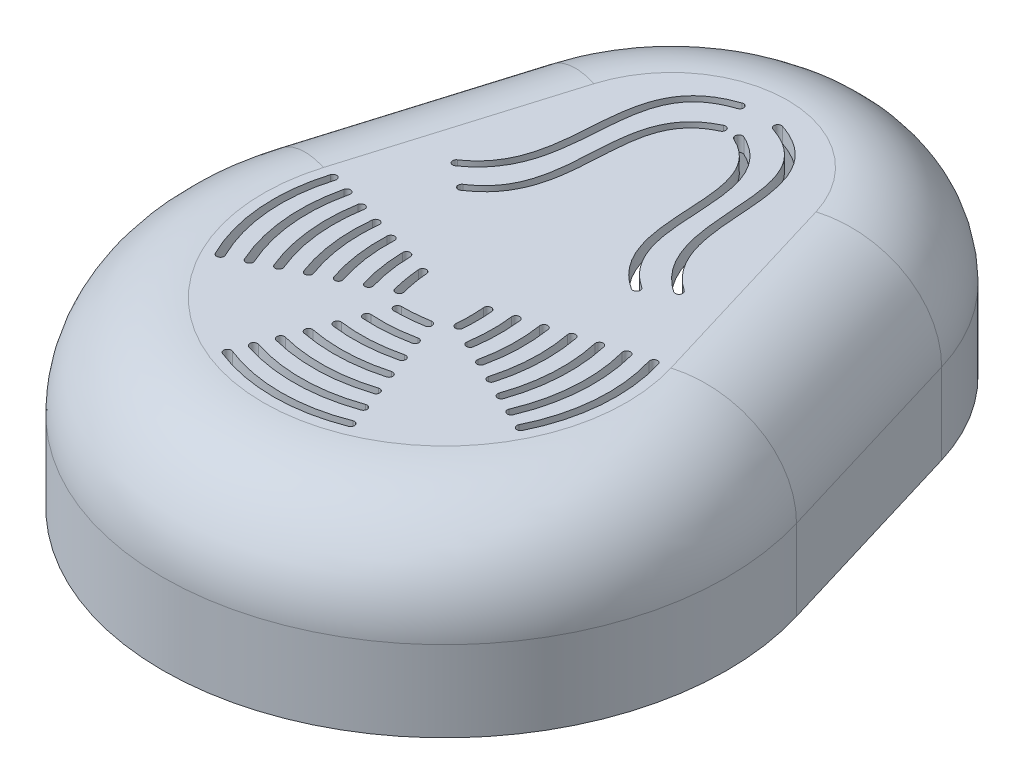
from build123d import *

# Parameters (mm, degrees)
SALIENTE_EXTRUIR3_DEPTH = 36
REDONDEO1_R             = 20
VACIADO1_T              = -3
CORTAR_EXTRUIR2_DEPTH   = 100.538937105
SALIENTE_EXTRUIR4_REACH = 101.539
CROQUIS11_R             = 3.6
CORTAR_EXTRUIR3_DEPTH   = 3


with BuildPart() as part:
    # Croquis6 → Saliente-Extruir3 (new body)
    with BuildSketch(Plane(origin=(0, 0, 0), x_dir=(1, 0, 0), z_dir=(0, 1, 0))):
        with BuildLine():
            Line((-53.612307413, 2.177777778), (-41.166593192, 43.422222222))
            ThreePointArc((-41.166593192, 43.422222222), (0, 74), (41.166593192, 43.422222222))
            Line((41.166593192, 43.422222222), (53.612307413, 2.177777778))
            ThreePointArc((53.612307413, 2.177777778), (0, -70), (-53.612307413, 2.177777778))
        make_face()
    extrude(amount=SALIENTE_EXTRUIR3_DEPTH)

    # Redondeo1
    redondeo1_edges = [part.edges().sort_by_distance(p)[0] for p in [
        (0, 36, -74),
        (-47.389450303, 36, -22.8),
        (0, 36, 70),
        (47.389450303, 36, -22.8),
    ]]
    fillet(redondeo1_edges, radius=REDONDEO1_R)

    # Vaciado1
    vaciado1_openings = [part.faces().sort_by_distance(p)[0] for p in [
        (0, 0, 0.578119369),
    ]]
    offset(amount=VACIADO1_T, openings=vaciado1_openings, kind=Kind.INTERSECTION)

    # Croquis8 → Cortar-Extruir2 (cut, through all)
    with BuildSketch(Plane(origin=(0, 36, 0), x_dir=(1, 0, 0), z_dir=(0, 1, 0))):
        with BuildLine():
            ThreePointArc((-32.550329501, -4.177777778), (-33.881791217, -16.832706114), (-30.467457358, -29.090859555))
            ThreePointArc((-30.467457358, -29.090859555), (-29.462494485, -29.430049212), (-29.123304828, -28.425086339))
            ThreePointArc((-29.123304828, -28.425086339), (-32.38700631, -16.707733785), (-31.114285552, -4.611111111))
            ThreePointArc((-31.114285552, -4.611111111), (-31.61564086, -3.67642247), (-32.550329501, -4.177777778))
        make_face()
        with BuildLine():
            ThreePointArc((-28.69329001, -5.341658438), (-29.441166671, -16.442842187), (-26.56514543, -27.191056082))
            ThreePointArc((-26.56514543, -27.191056082), (-25.572320196, -27.564282628), (-25.19909365, -26.571457394))
            ThreePointArc((-25.19909365, -26.571457394), (-27.948231601, -16.297429406), (-27.233349499, -5.686003764))
            ThreePointArc((-27.233349499, -5.686003764), (-27.791147092, -4.783860845), (-28.69329001, -5.341658438))
        make_face()
        with BuildLine():
            ThreePointArc((-24.712728102, -6.542812597), (-24.993827449, -16.05576998), (-22.627303805, -25.273955314))
            ThreePointArc((-22.627303805, -25.273955314), (-21.647781512, -25.680816563), (-21.240920263, -24.701294269))
            ThreePointArc((-21.240920263, -24.701294269), (-23.503038451, -15.889793582), (-23.234340546, -6.796525495))
            ThreePointArc((-23.234340546, -6.796525495), (-23.846677874, -5.930475268), (-24.712728102, -6.542812597))
        make_face()
        with BuildLine():
            ThreePointArc((-20.606501833, -7.781886594), (-20.539215096, -15.674786748), (-18.653770784, -23.339478529))
            ThreePointArc((-18.653770784, -23.339478529), (-17.688722035, -23.779570465), (-17.248630099, -22.814521716))
            ThreePointArc((-17.248630099, -22.814521716), (-19.050893044, -15.487978103), (-19.115211249, -7.943294132))
            ThreePointArc((-19.115211249, -7.943294132), (-19.780152772, -7.116945071), (-20.606501833, -7.781886594))
        make_face()
        with BuildLine():
            ThreePointArc((-16.37090047, -9.060000164), (-16.076541358, -15.303434023), (-14.644257223, -21.38748496))
            ThreePointArc((-14.644257223, -21.38748496), (-13.694862107, -21.860400295), (-13.221946773, -20.911005179))
            ThreePointArc((-13.221946773, -20.911005179), (-14.591041901, -15.095368254), (-14.872414582, -9.127380006))
            ThreePointArc((-14.872414582, -9.127380006), (-15.587967605, -8.344447141), (-16.37090047, -9.060000164))
        make_face()
        with BuildLine():
            ThreePointArc((-12.000412156, -10.378816535), (-11.604733963, -14.945658176), (-10.598341372, -19.417769282))
            ThreePointArc((-10.598341372, -19.417769282), (-9.665793809, -19.923095953), (-9.160467139, -18.990548391))
            ThreePointArc((-9.160467139, -18.990548391), (-10.122460057, -14.715736303), (-10.500681859, -10.350372971))
            ThreePointArc((-10.500681859, -10.350372971), (-11.26476879, -9.614729605), (-12.000412156, -10.378816535))
        make_face()
        with BuildLine():
            ThreePointArc((-7.487350668, -11.740655064), (-7.122352796, -14.606017153), (-6.515461153, -17.430057853))
            ThreePointArc((-6.515461153, -17.430057853), (-5.6009735, -17.967377435), (-5.063653919, -17.052889781))
            ThreePointArc((-5.063653919, -17.052889781), (-5.64377093, -14.353439112), (-5.992665955, -11.614490056))
            ThreePointArc((-5.992665955, -11.614490056), (-6.803090815, -10.930230204), (-7.487350668, -11.740655064))
        make_face()
        with BuildLine():
            ThreePointArc((-12.5, -45.618823508), (0, -48), (12.5, -45.618823508))
            ThreePointArc((12.5, -45.618823508), (12.921738754, -44.645614165), (11.948529412, -44.223875412))
            ThreePointArc((11.948529412, -44.223875412), (0, -46.5), (-11.948529412, -44.223875412))
            ThreePointArc((-11.948529412, -44.223875412), (-12.921738754, -44.645614165), (-12.5, -45.618823508))
        make_face()
        with BuildLine():
            ThreePointArc((-11.018817033, -41.872162482), (-0.018538349, -43.542332833), (10.931922301, -41.571796951))
            ThreePointArc((10.931922301, -41.571796951), (11.38656836, -40.613518828), (10.428290237, -40.158872769))
            ThreePointArc((10.428290237, -40.158872769), (-0.039061855, -42.042473244), (-10.554034126, -40.445986879))
            ThreePointArc((-10.554034126, -40.445986879), (-11.499513381, -40.926683227), (-11.018817033, -41.872162482))
        make_face()
        with BuildLine():
            ThreePointArc((-9.490198901, -38.005513929), (-0.033735252, -39.078206927), (9.349567598, -37.487923103))
            ThreePointArc((9.349567598, -37.487923103), (9.836623088, -36.545703941), (8.894403926, -36.05864845))
            ThreePointArc((8.894403926, -36.05864845), (-0.07492968, -37.578772694), (-9.114196404, -36.553404387))
            ThreePointArc((-9.114196404, -36.553404387), (-10.028252424, -37.091457909), (-9.490198901, -38.005513929))
        make_face()
        with BuildLine():
            ThreePointArc((-7.913323056, -34.016797205), (-0.042258389, -34.607340479), (7.752870913, -33.367034266))
            ThreePointArc((7.752870913, -33.367034266), (8.271835695, -32.442006939), (7.346808369, -31.923042157))
            ThreePointArc((7.346808369, -31.923042157), (-0.10441817, -33.108628979), (-7.628229984, -32.544139084))
            ThreePointArc((-7.628229984, -32.544139084), (-8.50710558, -33.137921608), (-7.913323056, -34.016797205))
        make_face()
        with BuildLine():
            ThreePointArc((-6.286764497, -29.902407766), (-0.040512869, -30.129243038), (6.141716061, -29.208830576))
            ThreePointArc((6.141716061, -29.208830576), (6.692085943, -28.302137137), (5.785392504, -27.751767255))
            ThreePointArc((5.785392504, -27.751767255), (-0.124091032, -28.631573285), (-6.094772736, -28.414745451))
            ThreePointArc((-6.094772736, -28.414745451), (-6.934599774, -29.062580728), (-6.286764497, -29.902407766))
        make_face()
        with BuildLine():
            ThreePointArc((-4.608406559, -25.65699149), (-0.024476705, -25.643174852), (4.515933567, -25.01287464))
            ThreePointArc((4.515933567, -25.01287464), (5.097198448, -24.125670527), (4.209994334, -23.544405646))
            ThreePointArc((4.209994334, -23.544405646), (-0.13010372, -24.146898496), (-4.511801374, -24.160105576))
            ThreePointArc((-4.511801374, -24.160105576), (-5.308546923, -24.860245941), (-4.608406559, -25.65699149))
        make_face()
        with BuildLine():
            ThreePointArc((-2.875297571, -21.273082114), (0.010512186, -21.148080556), (2.875297571, -20.778583539))
            ThreePointArc((2.875297571, -20.778583539), (3.486939472, -19.912042031), (2.620397964, -19.30040013))
            ThreePointArc((2.620397964, -19.30040013), (-0.11799983, -19.653595808), (-2.876494451, -19.773082592))
            ThreePointArc((-2.876494451, -19.773082592), (-3.625895772, -20.523680793), (-2.875297571, -21.273082114))
        make_face()
        with BuildLine():
            ThreePointArc((30.467457358, -29.090859555), (33.881791217, -16.832706114), (32.550329501, -4.177777778))
            ThreePointArc((32.550329501, -4.177777778), (31.61564086, -3.67642247), (31.114285552, -4.611111111))
            ThreePointArc((31.114285552, -4.611111111), (32.38700631, -16.707733785), (29.123304828, -28.425086339))
            ThreePointArc((29.123304828, -28.425086339), (29.462494485, -29.430049212), (30.467457358, -29.090859555))
        make_face()
        with BuildLine():
            ThreePointArc((26.857227047, -27.302673624), (29.43807763, -16.47978998), (28.386729144, -5.403226141))
            ThreePointArc((28.386729144, -5.403226141), (27.469661479, -4.87032193), (26.936757269, -5.787389595))
            ThreePointArc((26.936757269, -5.787389595), (27.941722733, -16.3752815), (25.474733205, -26.720684984))
            ThreePointArc((25.474733205, -26.720684984), (25.874985806, -27.702926225), (26.857227047, -27.302673624))
        make_face()
        with BuildLine():
            ThreePointArc((23.131378428, -25.457220702), (24.988206152, -16.123005908), (24.185220117, -6.639831943))
            ThreePointArc((24.185220117, -6.639831943), (23.286855768, -6.07596893), (22.722992756, -6.974333279))
            ThreePointArc((22.722992756, -6.974333279), (23.490552936, -16.039131922), (21.715644083, -24.961543122))
            ThreePointArc((21.715644083, -24.961543122), (22.175672466, -25.917249085), (23.131378428, -25.457220702))
        make_face()
        with BuildLine():
            ThreePointArc((19.287906621, -23.553507748), (20.53217359, -15.759009685), (19.945629892, -7.887645963))
            ThreePointArc((19.945629892, -7.887645963), (19.067056126, -7.293416935), (18.472827097, -8.171990701))
            ThreePointArc((18.472827097, -8.171990701), (19.033493868, -15.696088376), (17.84412103, -23.146711524))
            ThreePointArc((17.84412103, -23.146711524), (18.362615714, -24.072002432), (19.287906621, -23.553507748))
        make_face()
        with BuildLine():
            ThreePointArc((15.32333834, -21.589814407), (16.069790708, -15.384178057), (15.667649967, -9.146759002))
            ThreePointArc((15.667649967, -9.146759002), (14.809962858, -8.522761546), (14.185965403, -9.380448654))
            ThreePointArc((14.185965403, -9.380448654), (14.570364641, -15.342687457), (13.856843995, -21.274545733))
            ThreePointArc((13.856843995, -21.274545733), (14.43245683, -22.165427242), (15.32333834, -21.589814407))
        make_face()
        with BuildLine():
            ThreePointArc((11.232514425, -19.563585292), (11.600655415, -14.994441388), (11.350830349, -10.417303501))
            ThreePointArc((11.350830349, -10.417303501), (10.515138821, -9.764142212), (9.861977532, -10.59983374))
            ThreePointArc((9.861977532, -10.59983374), (10.100780904, -14.975039073), (9.748881428, -19.342603099))
            ThreePointArc((9.748881428, -19.342603099), (10.38020683, -20.194910694), (11.232514425, -19.563585292))
        make_face()
        with BuildLine():
            ThreePointArc((7.008240491, -17.471256946), (7.124104439, -14.585065876), (6.99457133, -11.699455972))
            ThreePointArc((6.99457133, -11.699455972), (6.182001427, -11.017744778), (5.500290232, -11.830314681))
            ThreePointArc((5.500290232, -11.830314681), (5.624108645, -14.588618265), (5.513356342, -17.347477376))
            ThreePointArc((5.513356342, -17.347477376), (6.198908632, -18.156809235), (7.008240491, -17.471256946))
        make_face()
        with BuildLine():
            ThreePointArc((-4, 49), (-3.051519561, 48.525252849), (-3.526266712, 47.57677241))
            add(Edge.make_bspline(
                [(-3.526266712, 47.57677241), (-3.786359925, 47.490198194), (-4.311801885, 47.303063565), (-5.275902782, 46.910816369), (-6.373397666, 46.372379232), (-7.517873627, 45.661461902), (-8.841958291, 44.631707303), (-10.160419959, 43.198860283), (-11.327594581, 41.239555408), (-12.161948913, 39.033384738), (-12.915215395, 35.791326977), (-13.345251945, 31.278459398), (-13.67517189, 25.505101639), (-14.398110366, 20.67109281), (-15.655268397, 16.952537346), (-17.046347502, 14.297357133), (-18.666872659, 12.256575014), (-20.26045324, 10.779123974), (-21.184788339, 10.081240653), (-21.655019273, 9.760642275)],
                knots=[0, 0, 0, 0, 0.015625, 0.03125, 0.0625, 0.09375, 0.125, 0.1875, 0.25, 0.3125, 0.375, 0.5, 0.625, 0.75, 0.8125, 0.875, 0.9375, 0.96875, 1, 1, 1, 1], degree=3))
            ThreePointArc((-21.655019273, 9.760642275), (-22.697188499, 9.957830774), (-22.5, 11))
            add(Edge.make_bspline(
                [(-4, 49), (-22.305675607, 42.906801732), (-8.354261931, 20.644411617), (-22.5, 11)],
                knots=[0, 0, 0, 0, 1, 1, 1, 1], degree=3))
        make_face()
        with BuildLine():
            ThreePointArc((-2, 43.343145751), (-1.002081677, 42.983758745), (-1.361468683, 41.985840421))
            add(Edge.make_bspline(
                [(-1.361468683, 41.985840421), (-1.766026671, 41.795519983), (-2.581074127, 41.365444747), (-3.944172983, 40.460578011), (-5.328803309, 39.189527581), (-6.555966895, 37.4650069), (-7.450652848, 35.521026174), (-8.069594362, 33.363217497), (-8.602151609, 30.237680563), (-8.870313975, 25.964514311), (-9.135108651, 20.576047655), (-9.854136274, 16.096568943), (-11.102745891, 12.663488124), (-12.473140056, 10.221492526), (-14.05190932, 8.354648596), (-15.590471223, 7.008696452), (-16.478820253, 6.374140711), (-16.929254454, 6.083169966)],
                knots=[0, 0, 0, 0, 0.03125, 0.0625, 0.125, 0.1875, 0.25, 0.3125, 0.375, 0.5, 0.625, 0.75, 0.8125, 0.875, 0.9375, 0.96875, 1, 1, 1, 1], degree=3))
            ThreePointArc((-16.929254454, 6.083169966), (-17.966200889, 6.306199315), (-17.74317154, 7.343145751))
            add(Edge.make_bspline(
                [(-2, 43.343145751), (-16.824850777, 36.368936414), (-4.216739375, 16.080928163), (-17.74317154, 7.343145751)],
                knots=[0, 0, 0, 0, 1, 1, 1, 1], degree=3))
        make_face()
        with BuildLine():
            ThreePointArc((4, 49), (3.051519561, 48.525252849), (3.526266712, 47.57677241))
            add(Edge.make_bspline(
                [(3.526266712, 47.57677241), (3.786359925, 47.490198194), (4.311801885, 47.303063565), (5.275902782, 46.910816369), (6.373397666, 46.372379232), (7.517873627, 45.661461902), (8.841958291, 44.631707303), (10.160419959, 43.198860283), (11.327594581, 41.239555408), (12.161948913, 39.033384738), (12.915215395, 35.791326977), (13.345251945, 31.278459398), (13.67517189, 25.505101639), (14.398110366, 20.67109281), (15.655268397, 16.952537346), (17.046347502, 14.297357133), (18.666872659, 12.256575014), (20.26045324, 10.779123974), (21.184788339, 10.081240653), (21.655019273, 9.760642275)],
                knots=[0, 0, 0, 0, 0.015625, 0.03125, 0.0625, 0.09375, 0.125, 0.1875, 0.25, 0.3125, 0.375, 0.5, 0.625, 0.75, 0.8125, 0.875, 0.9375, 0.96875, 1, 1, 1, 1], degree=3))
            ThreePointArc((21.655019273, 9.760642275), (22.697188499, 9.957830774), (22.5, 11))
            add(Edge.make_bspline(
                [(4, 49), (22.305675607, 42.906801732), (8.354261931, 20.644411617), (22.5, 11)],
                knots=[0, 0, 0, 0, 1, 1, 1, 1], degree=3))
        make_face()
        with BuildLine():
            ThreePointArc((2, 43.343145751), (1.002081677, 42.983758745), (1.361468683, 41.985840421))
            add(Edge.make_bspline(
                [(1.361468683, 41.985840421), (1.766026671, 41.795519983), (2.581074127, 41.365444747), (3.944172983, 40.460578011), (5.328803309, 39.189527581), (6.555966895, 37.4650069), (7.450652848, 35.521026174), (8.069594362, 33.363217497), (8.602151609, 30.237680563), (8.870313975, 25.964514311), (9.135108651, 20.576047655), (9.854136274, 16.096568943), (11.102745891, 12.663488124), (12.473140056, 10.221492526), (14.05190932, 8.354648596), (15.590471223, 7.008696452), (16.478820253, 6.374140711), (16.929254454, 6.083169966)],
                knots=[0, 0, 0, 0, 0.03125, 0.0625, 0.125, 0.1875, 0.25, 0.3125, 0.375, 0.5, 0.625, 0.75, 0.8125, 0.875, 0.9375, 0.96875, 1, 1, 1, 1], degree=3))
            ThreePointArc((16.929254454, 6.083169966), (17.966200889, 6.306199315), (17.74317154, 7.343145751))
            add(Edge.make_bspline(
                [(2, 43.343145751), (16.824850777, 36.368936414), (4.216739375, 16.080928163), (17.74317154, 7.343145751)],
                knots=[0, 0, 0, 0, 1, 1, 1, 1], degree=3))
        make_face()
    extrude(amount=-CORTAR_EXTRUIR2_DEPTH, mode=Mode.SUBTRACT)

    # Croquis10 → Saliente-Extruir4 (add, up to next)
    with BuildSketch(Plane.XZ, mode=Mode.PRIVATE) as saliente_extruir4_sk1:
        with BuildLine():
            Line((40.184412955, 35), (48.662100242, 35))
            ThreePointArc((48.662100242, 35), (46.097203795, 40.154307527), (42.98837052, 45))
            Line((42.98837052, 45), (40.184412955, 45))
            ThreePointArc((40.184412955, 45), (35.184412955, 40), (40.184412955, 35))
        make_face()
    saliente_extruir4_tool1 = extrude(saliente_extruir4_sk1.sketch, amount=-SALIENTE_EXTRUIR4_REACH, mode=Mode.PRIVATE) - part.part
    # Croquis10 → Saliente-Extruir4 (add, up to next)
    with BuildSketch(Plane.XZ, mode=Mode.PRIVATE) as saliente_extruir4_sk2:
        with BuildLine():
            Line((-38.794077337, -40.9), (-34.30285196, -40.9))
            ThreePointArc((-34.30285196, -40.9), (-29.30285196, -35.9), (-34.30285196, -30.9))
            Line((-34.30285196, -30.9), (-41.811626582, -30.9))
            Line((-41.811626582, -30.9), (-38.794077337, -40.9))
        make_face()
    saliente_extruir4_tool2 = extrude(saliente_extruir4_sk2.sketch, amount=-SALIENTE_EXTRUIR4_REACH, mode=Mode.PRIVATE) - part.part
    # Croquis10 → Saliente-Extruir4 (add, up to next)
    with BuildSketch(Plane.XZ, mode=Mode.PRIVATE) as saliente_extruir4_sk3:
        with BuildLine():
            Line((-48.662100242, 35), (-40.184412955, 35))
            ThreePointArc((-40.184412955, 35), (-35.184412955, 40), (-40.184412955, 45))
            Line((-40.184412955, 45), (-42.98837052, 45))
            ThreePointArc((-42.98837052, 45), (-46.097203795, 40.154307527), (-48.662100242, 35))
        make_face()
    saliente_extruir4_tool3 = extrude(saliente_extruir4_sk3.sketch, amount=-SALIENTE_EXTRUIR4_REACH, mode=Mode.PRIVATE) - part.part
    # Croquis10 → Saliente-Extruir4 (add, up to next)
    with BuildSketch(Plane.XZ, mode=Mode.PRIVATE) as saliente_extruir4_sk4:
        with BuildLine():
            Line((38.794077337, -40.9), (41.811626582, -30.9))
            Line((41.811626582, -30.9), (34.30285196, -30.9))
            ThreePointArc((34.30285196, -30.9), (29.30285196, -35.9), (34.30285196, -40.9))
            Line((34.30285196, -40.9), (38.794077337, -40.9))
        make_face()
    saliente_extruir4_tool4 = extrude(saliente_extruir4_sk4.sketch, amount=-SALIENTE_EXTRUIR4_REACH, mode=Mode.PRIVATE) - part.part
    add(saliente_extruir4_tool1.solids().sort_by_distance((41.234237, 0, 39.519425))[0])
    add(saliente_extruir4_tool2.solids().sort_by_distance((-35.314847, 0, -35.646688))[0])
    add(saliente_extruir4_tool3.solids().sort_by_distance((-41.234237, 0, 39.519425))[0])
    add(saliente_extruir4_tool4.solids().sort_by_distance((35.314847, 0, -35.646688))[0])

    # Croquis11 → Cortar-Extruir3 (cut)
    with BuildSketch(Plane.XZ):
        with Locations(Location((34.30285196, -35.9, 0), (0, 0, 270))):
            Circle(CROQUIS11_R)
        with Locations(Location((-34.30285196, -35.9, 0), (0, 0, 270))):
            Circle(CROQUIS11_R)
        with Locations(Location((-40.184412955, 40, 0), (0, 0, 270))):
            Circle(CROQUIS11_R)
        with Locations(Location((40.184412955, 40, 0), (0, 0, 270))):
            Circle(CROQUIS11_R)
    extrude(amount=-CORTAR_EXTRUIR3_DEPTH, mode=Mode.SUBTRACT)


solid = part.part
